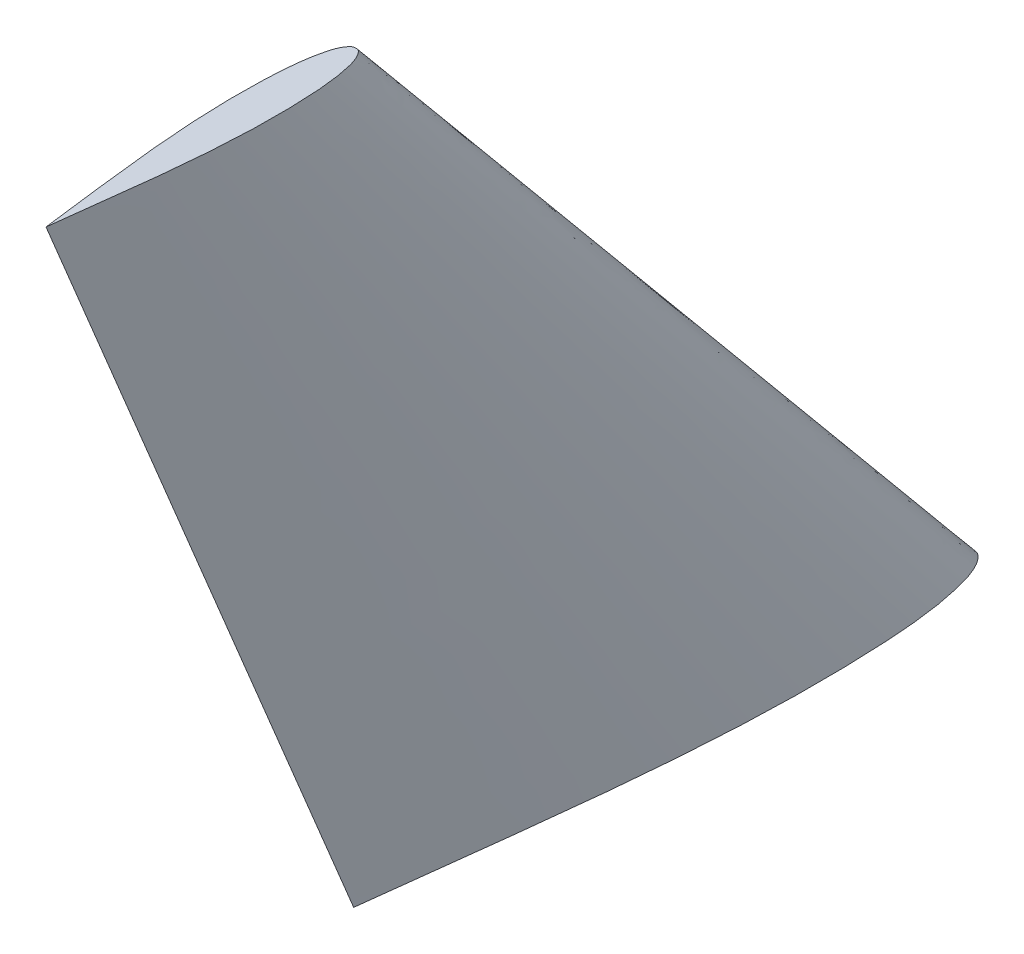
from build123d import *


with BuildPart() as part:
    # Sketch1 → Loft2 section 0
    with BuildSketch(Plane(origin=(0, 0, 0), x_dir=(1, 0, 0), z_dir=(0, 1, 0))):
        with BuildLine():
            add(Edge.make_bspline(
                [(0, 2790.142248), (32.430553625, 2797.703951889), (84.214543249, 2759.265706913), (160.784275423, 2647.858910625), (216.236511451, 2472.626717932), (292.945329004, 2117.625832168), (431.079514036, 352.45492096), (168.44618418, -1327.507749315), (0, -2790.142248)],
                knots=[0, 0, 0, 0, 0.015891886, 0.031409134, 0.071418258, 0.111026583, 0.223280699, 1, 1, 1, 1], degree=3))
            add(Edge.make_bspline(
                [(0, 2790.142248), (-32.430553625, 2797.703951889), (-84.214543249, 2759.265706913), (-160.784275423, 2647.858910625), (-216.236511451, 2472.626717932), (-292.945329004, 2117.625832168), (-431.079514036, 352.45492096), (-168.44618418, -1327.507749315), (0, -2790.142248)],
                knots=[0, 0, 0, 0, 0.015891886, 0.031409134, 0.071418258, 0.111026583, 0.223280699, 1, 1, 1, 1], degree=3))
        make_face()
    # Sketch3 → Loft2 section 1
    with BuildSketch(Plane(origin=(0, 6696.456, 0), x_dir=(1, 0, 0), z_dir=(0, 1, 0))):
        with BuildLine():
            add(Edge.make_bspline(
                [(0, -2772.653537317), (16.979917738, -2767.145303222), (40.19109194, -2785.805982638), (82.345210822, -2843.24208975), (112.463446335, -2942.340700836), (146.975535405, -3121.723529001), (216.027003639, -4000.057912964), (88.17867211, -4833.010074602), (0, -5562.795175717)],
                knots=[0, 0, 0, 0, 0.016437361, 0.028569, 0.075697162, 0.122460319, 0.221963949, 1, 1, 1, 1], degree=3))
            add(Edge.make_bspline(
                [(0, -2772.653537317), (-16.979917738, -2767.145303222), (-40.19109194, -2785.805982638), (-82.345210822, -2843.24208975), (-112.463446335, -2942.340700836), (-146.975535405, -3121.723529001), (-216.027003639, -4000.057912964), (-88.17867211, -4833.010074602), (0, -5562.795175717)],
                knots=[0, 0, 0, 0, 0.016437361, 0.028569, 0.075697162, 0.122460319, 0.221963949, 1, 1, 1, 1], degree=3))
        make_face()
    loft()


solid = part.part
